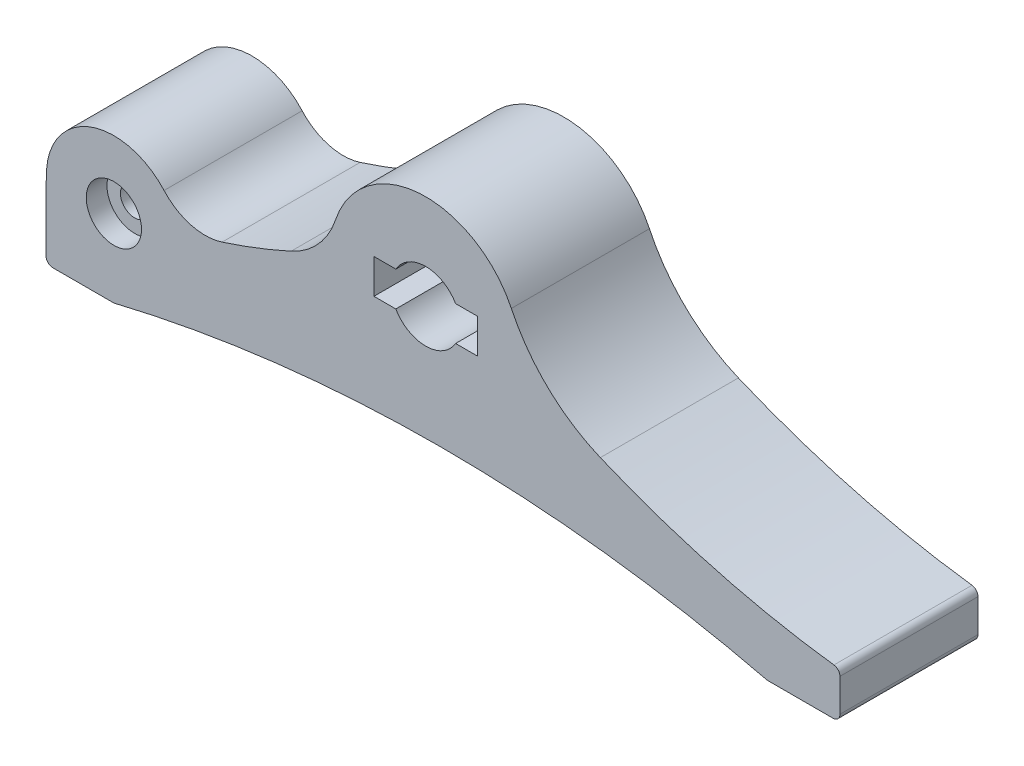
from build123d import *

# Parameters (mm, degrees)
SKETCH_1_R          = 2.05
EXTRUDE_1_DEPTH     = 20
FILLET_1_R          = 12
FILLET_2_R          = 8
FILLET_3_R          = 1
FILLET_4_R          = 25
SKETCH_6_R          = 4
CUT_EXTRUDE_5_DEPTH = 3
SKETCH_7_R          = 1.25
CUT_EXTRUDE1_DEPTH  = 10
CUT_EXTRUDE2_START  = -3
SKETCH1_R           = 4
CUT_EXTRUDE2_DEPTH  = 3


with BuildPart() as part:
    # 草图1 → 凸台-拉伸1 (new body)
    with BuildSketch(Plane.XY):
        with BuildLine():
            Line((13.750969278, -0.819876155), (13.750969278, -0.183047918))
            ThreePointArc((13.750969278, -0.183047918), (0.091525986, 13.751882984), (-13.752187557, 0))
            ThreePointArc((-13.752187557, 0), (-24.470803545, -4.924054358), (-35.721657685, -8.467120986))
            ThreePointArc((-35.721657685, -8.467120986), (-46.713142569, -1.298230159), (-54.919247866, -11.538619386))
            Line((-54.919247866, -11.538619386), (-55, -11.852756493))
            Line((-55, -11.852756493), (-55, -22.177115611))
            Line((-55, -22.177115611), (-45.17004572, -22.177115611))
            ThreePointArc((-45.17004572, -22.177115611), (2.155746263, -16.550210115), (49.481538246, -22.177115611))
            Line((49.481538246, -22.177115611), (60, -22.177115611))
            Line((60, -22.177115611), (60, -15.54238751))
            ThreePointArc((60, -15.54238751), (36.185940998, -10.347251745), (13.750969278, -0.819876155))
        make_face()
        with Locations((-45.17004572, -10.942949795)):
            Circle(SKETCH_1_R, mode=Mode.SUBTRACT)
        with BuildLine():
            Line((-7.5, -2.5), (-7.5, 2.5))
            Line((-7.5, 2.5), (-4.330127019, 2.5))
            ThreePointArc((-4.330127019, 2.5), (0, 5), (4.330127019, 2.5))
            Line((4.330127019, 2.5), (7.5, 2.5))
            Line((7.5, 2.5), (7.5, -2.5))
            Line((7.5, -2.5), (4.330127019, -2.5))
            ThreePointArc((4.330127019, -2.5), (0, -5), (-4.330127019, -2.5))
            Line((-4.330127019, -2.5), (-7.5, -2.5))
        make_face(mode=Mode.SUBTRACT)
    extrude(amount=EXTRUDE_1_DEPTH)

    # 圆角1
    fillet_1_edges = [part.edges().sort_by_distance(p)[0] for p in [
        (-13.752187557, 0, 10),
    ]]
    fillet(fillet_1_edges, radius=FILLET_1_R)

    # 圆角2
    fillet_2_edges = [part.edges().sort_by_distance(p)[0] for p in [
        (-35.721657685, -8.467120986, 10),
    ]]
    fillet(fillet_2_edges, radius=FILLET_2_R)

    # 圆角3
    fillet_3_edges = [part.edges().sort_by_distance(p)[0] for p in [
        (60, -15.54238751, 10),
        (60, -22.177115611, 10),
        (-55, -22.177115611, 10),
    ]]
    fillet(fillet_3_edges, radius=FILLET_3_R)

    # 圆角4
    fillet_4_edges = [part.edges().sort_by_distance(p)[0] for p in [
        (13.750969278, -0.819876155, 10),
    ]]
    fillet(fillet_4_edges, radius=FILLET_4_R)

    # 草图6 → 切除-拉伸5 (cut)
    with BuildSketch(Plane(origin=(0, 0, 0), x_dir=(-1, 0, 0), z_dir=(0, 0, -1))):
        with Locations((45.17004572, -10.942949795)):
            Circle(SKETCH_6_R)
    extrude(amount=-CUT_EXTRUDE_5_DEPTH, mode=Mode.SUBTRACT)

    # 草图7 → Cut-Extrude1 (cut)
    with BuildSketch(Plane.XY):
        with Locations((-49.334528207, -19.024990649)):
            Circle(SKETCH_7_R)
        with Locations((54.787690727, -19.024990649)):
            Circle(SKETCH_7_R)
        with Locations((34.734293207, -16.420229149)):
            Circle(SKETCH_7_R)
        with Locations((-28.075836585, -16.420229149)):
            Circle(SKETCH_7_R)
    extrude(amount=CUT_EXTRUDE1_DEPTH, mode=Mode.SUBTRACT)

    # Sketch1 → Cut-Extrude2 (cut)
    with BuildSketch(Plane.XY.offset(20).offset(CUT_EXTRUDE2_START)):
        with Locations(Location((-45.17004572, -10.942949795, 0), (0, 0, 180))):
            Circle(SKETCH1_R)
    extrude(amount=CUT_EXTRUDE2_DEPTH, mode=Mode.SUBTRACT)


solid = part.part
